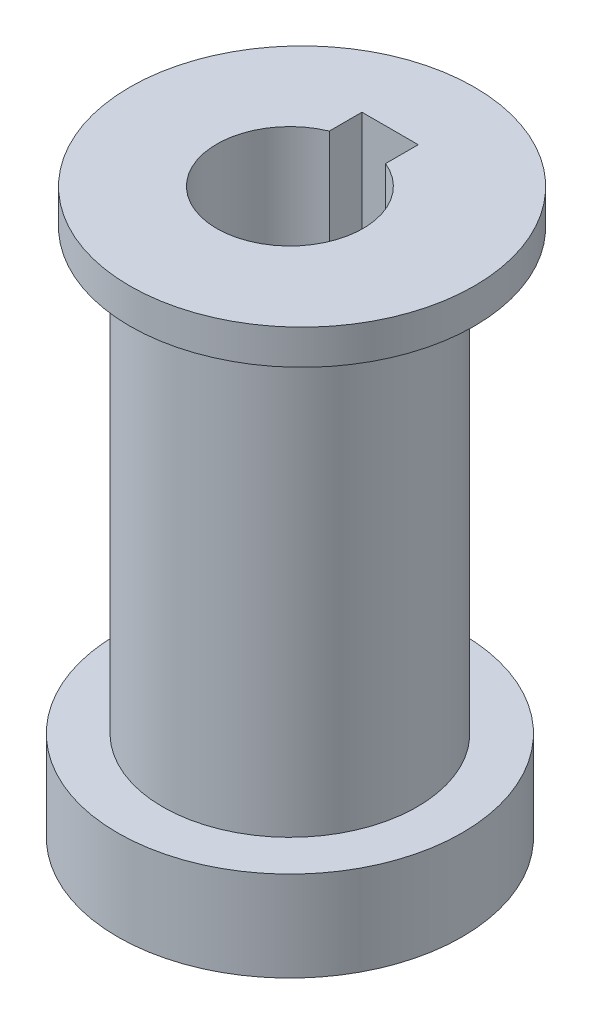
from build123d import *

# Parameters (mm, degrees)
SKETCH1_R           = 15.3
BOSS_EXTRUDE1_DEPTH = 8
SKETCH2_R           = 11.3
BOSS_EXTRUDE2_DEPTH = 39
SKETCH3_R           = 15.3
BOSS_EXTRUDE3_DEPTH = 3.088651712
CUT_EXTRUDE4_DEPTH  = 51


with BuildPart() as part:
    # Sketch1 → Boss-Extrude1 (new body)
    with BuildSketch(Plane(origin=(0, 0, 0), x_dir=(1, 0, 0), z_dir=(0, 1, 0))):
        with Locations(Location((0, 0, 0), (0, 0, 270))):
            Circle(SKETCH1_R)
    extrude(amount=BOSS_EXTRUDE1_DEPTH)

    # Sketch2 → Boss-Extrude2 (add)
    with BuildSketch(Plane(origin=(0, 8, 0), x_dir=(1, 0, 0), z_dir=(0, 1, 0))):
        with Locations(Location((0, 0, 0), (0, 0, 270))):
            Circle(SKETCH2_R)
    extrude(amount=BOSS_EXTRUDE2_DEPTH)

    # Sketch3 → Boss-Extrude3 (add)
    with BuildSketch(Plane(origin=(0, 47, 0), x_dir=(1, 0, 0), z_dir=(0, 1, 0))):
        with Locations(Location((0.559173948, 0.524225576, 0), (0, 0, 270))):
            Circle(SKETCH3_R)
    extrude(amount=BOSS_EXTRUDE3_DEPTH)

    # Sketch6 → Cut-Extrude4 (cut)
    with BuildSketch(Plane(origin=(0, 50.088651712, 0), x_dir=(1, 0, 0), z_dir=(0, 1, 0))):
        with BuildLine():
            Line((-2.5, 8.9), (2.5, 8.9))
            Line((2.5, 8.9), (2.5, 6))
            ThreePointArc((2.5, 6), (0, -6.5), (-2.5, 6))
            Line((-2.5, 6), (-2.5, 8.9))
        make_face()
    extrude(amount=-CUT_EXTRUDE4_DEPTH, mode=Mode.SUBTRACT)


solid = part.part
